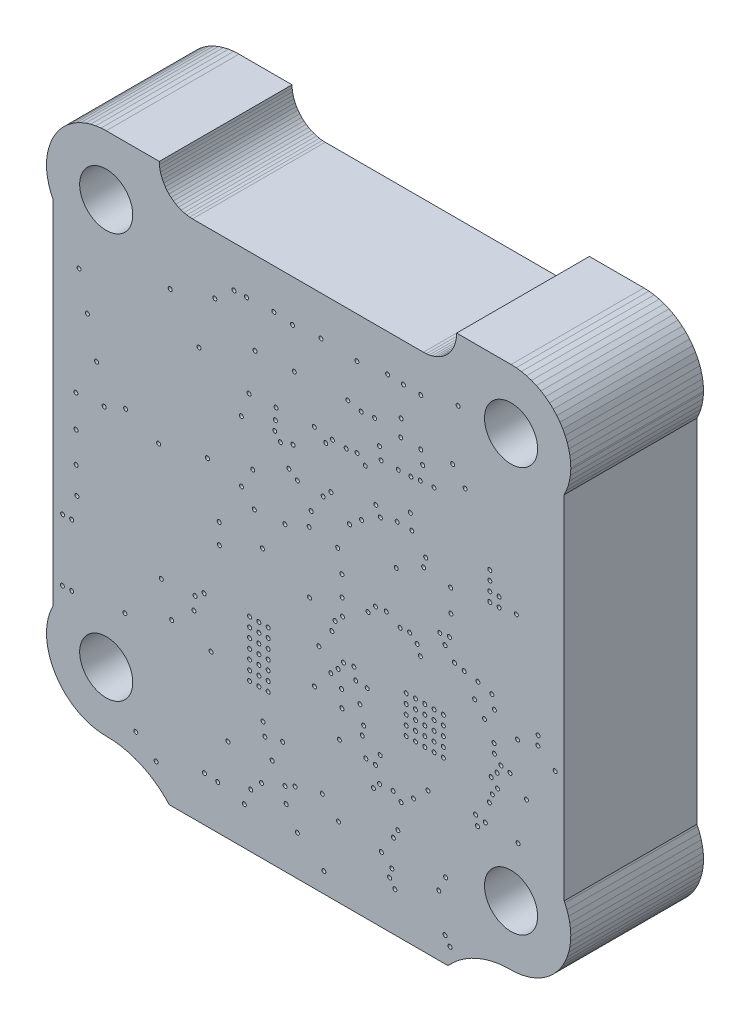
from build123d import *

# Parameters (mm, degrees)
MODEL_R         = 2
MODEL_R_2       = 0.15
EXTRUDE_1_DEPTH = 10


with BuildPart() as part:
    # Model → Бобышка-Вытянуть1 (new body)
    with BuildSketch(Plane.XY):
        Polygon((0, 6.6), (0.017125, 6.2078), (0.068365625, 5.818584375), (0.153334375, 5.435315625), (0.271384375, 5.060909375), (0.421615625, 4.69821875), (0.602884375, 4.350003125), (0.813815625, 4.018909375), (1.0528, 3.70745625), (1.31801875, 3.418021875), (1.607453125, 3.152803125), (1.91890625, 2.91381875), (2.249996875, 2.7028875), (2.598215625, 2.52161875), (2.96090625, 2.3713875), (3.3353125, 2.2533375), (3.71858125, 2.16836875), (4.107796875, 2.117128125), (4.5, 2.1), (5.0555625, 2.07761875), (5.6070625, 2.006903125), (6.1503, 1.8883875), (6.681140625, 1.722978125), (7.195546875, 1.511934375), (7.6896, 1.256859375), (8.159540625, 0.95969375), (8.60179375, 0.6227), (9.01299375, 0.248446875), (9.25, 0), (30.25, 0), (30.64045, 0.39585625), (31.0639125, 0.756175), (31.51716875, 1.07821875), (31.99676875, 1.359528125), (32.4990625, 1.597971875), (33.020225, 1.791728125), (33.556290625, 1.939325), (34.10318125, 2.039640625), (34.656734375, 2.09190625), (35, 2.1), (35.3922, 2.117125), (35.781415625, 2.168365625), (36.164684375, 2.253334375), (36.539090625, 2.371384375), (36.90178125, 2.521615625), (37.25, 2.702884375), (37.58109375, 2.913815625), (37.89254375, 3.1528), (38.18198125, 3.41801875), (38.4472, 3.70745625), (38.686184375, 4.01890625), (38.897115625, 4.35), (39.078384375, 4.69821875), (39.228615625, 5.060909375), (39.346665625, 5.435315625), (39.431634375, 5.818584375), (39.482875, 6.2078), (39.5, 6.6), (39.477784375, 6.9907625), (39.421596875, 7.3781), (39.331865625, 7.75906875), (39.209271875, 8.130765625), (39.054746875, 8.490365625), (39, 8.6), (39, 35.1), (39.1642875, 35.45524375), (39.2969875, 35.823453125), (39.397090625, 36.20183125), (39.463834375, 36.587490625), (39.4967125, 36.9775), (39.5, 37.1), (39.482875, 37.4922), (39.431634375, 37.881415625), (39.346665625, 38.264684375), (39.228615625, 38.639090625), (39.078384375, 39.00178125), (38.897115625, 39.35), (38.686184375, 39.68109375), (38.4472, 39.99254375), (38.18198125, 40.28198125), (37.89254375, 40.5472), (37.58109375, 40.786184375), (37.25, 40.997115625), (36.90178125, 41.178384375), (36.539090625, 41.328615625), (36.164684375, 41.446665625), (35.781415625, 41.531634375), (35.3922, 41.582875), (35, 41.6), (30.9, 41.6), (30.8904875, 41.382109375), (30.86201875, 41.165878125), (30.814815625, 40.952953125), (30.74923125, 40.74495), (30.66576875, 40.543453125), (30.5650625, 40.35), (30.44788125, 40.166059375), (30.3151125, 39.99303125), (30.167765625, 39.832234375), (30.00696875, 39.6848875), (29.833940625, 39.55211875), (29.65, 39.4349375), (29.456546875, 39.33423125), (29.25505, 39.25076875), (29.047046875, 39.185184375), (28.834121875, 39.13798125), (28.617890625, 39.1095125), (28.4, 39.1), (11, 39.1), (10.782109375, 39.1095125), (10.565878125, 39.13798125), (10.352953125, 39.185184375), (10.14495, 39.25076875), (9.943453125, 39.33423125), (9.75, 39.4349375), (9.566059375, 39.55211875), (9.39303125, 39.6848875), (9.232234375, 39.832234375), (9.0848875, 39.99303125), (8.95211875, 40.166059375), (8.8349375, 40.35), (8.73423125, 40.543453125), (8.65076875, 40.74495), (8.585184375, 40.952953125), (8.53798125, 41.165878125), (8.5095125, 41.382109375), (8.5, 41.6), (4.5, 41.6), (4.1078, 41.582875), (3.718584375, 41.531634375), (3.335315625, 41.446665625), (2.960909375, 41.32861875), (2.59821875, 41.1783875), (2.25, 40.997115625), (1.91890625, 40.7861875), (1.60745625, 40.547203125), (1.31801875, 40.28198125), (1.0528, 39.992546875), (0.813815625, 39.681096875), (0.602884375, 39.350003125), (0.4216125, 39.001784375), (0.27138125, 38.63909375), (0.15333125, 38.2646875), (0.0683625, 37.88141875), (0.017121875, 37.492203125), (0, 37.1), (0.022215625, 36.7092375), (0.0784, 36.3219), (0.168134375, 35.94093125), (0.290728125, 35.569234375), (0.44525, 35.2096375), (0.5, 35.1), (0.5, 8.6), (0.3357125, 8.24475625), (0.2030125, 7.876546875), (0.102909375, 7.498171875), (0.0361625, 7.1125125), (0.003284375, 6.722503125), align=None)
        with Locations((4.5, 37.1)):
            Circle(MODEL_R, mode=Mode.SUBTRACT)
        with Locations((35, 37.1)):
            Circle(MODEL_R, mode=Mode.SUBTRACT)
        with Locations((4.5, 6.6)):
            Circle(MODEL_R, mode=Mode.SUBTRACT)
        with Locations((35, 6.6)):
            Circle(MODEL_R, mode=Mode.SUBTRACT)
        with Locations((4.343, 23.53)):
            Circle(MODEL_R_2, mode=Mode.SUBTRACT)
        with Locations((14.68, 28.07)):
            Circle(MODEL_R_2, mode=Mode.SUBTRACT)
        with Locations((3.08, 28.96)):
            Circle(MODEL_R_2, mode=Mode.SUBTRACT)
        with Locations((2.45, 31.59)):
            Circle(MODEL_R_2, mode=Mode.SUBTRACT)
        with Locations((17.96, 22.66)):
            Circle(MODEL_R_2, mode=Mode.SUBTRACT)
        with Locations((16.27, 20.24)):
            Circle(MODEL_R_2, mode=Mode.SUBTRACT)
        with Locations((14.69, 23.49)):
            Circle(MODEL_R_2, mode=Mode.SUBTRACT)
        with Locations((18.9, 25.99)):
            Circle(MODEL_R_2, mode=Mode.SUBTRACT)
        with Locations((17.6227125, 27.8372875)):
            Circle(MODEL_R_2, mode=Mode.SUBTRACT)
        with Locations((16, 13.2)):
            Circle(MODEL_R_2, mode=Mode.SUBTRACT)
        with Locations((28.5, 14.8)):
            Circle(MODEL_R_2, mode=Mode.SUBTRACT)
        with Locations((22.26, 12.8)):
            Circle(MODEL_R_2, mode=Mode.SUBTRACT)
        with Locations((8.45, 23.16)):
            Circle(MODEL_R_2, mode=Mode.SUBTRACT)
        with Locations((12.13, 24.05)):
            Circle(MODEL_R_2, mode=Mode.SUBTRACT)
        with Locations((36.16, 13.79)):
            Circle(MODEL_R_2, mode=Mode.SUBTRACT)
        with Locations((20.9, 1.5)):
            Circle(MODEL_R_2, mode=Mode.SUBTRACT)
        with Locations((16.45, 8.04)):
            Circle(MODEL_R_2, mode=Mode.SUBTRACT)
        with Locations((25.14, 11.18)):
            Circle(MODEL_R_2, mode=Mode.SUBTRACT)
        with Locations((21.040575, 29.502)):
            Circle(MODEL_R_2, mode=Mode.SUBTRACT)
        with Locations((30.06574375, 5.67425625)):
            Circle(MODEL_R_2, mode=Mode.SUBTRACT)
        with Locations((31.01, 36.91)):
            Circle(MODEL_R_2, mode=Mode.SUBTRACT)
        with Locations((29.19, 30.67)):
            Circle(MODEL_R_2, mode=Mode.SUBTRACT)
        with Locations((23.39, 36.01)):
            Circle(MODEL_R_2, mode=Mode.SUBTRACT)
        with Locations((18.53, 35.952)):
            Circle(MODEL_R_2, mode=Mode.SUBTRACT)
        with Locations((22.7, 33.11)):
            Circle(MODEL_R_2, mode=Mode.SUBTRACT)
        with Locations((15.07, 36.02)):
            Circle(MODEL_R_2, mode=Mode.SUBTRACT)
        with Locations((38.325, 16.73)):
            Circle(MODEL_R_2, mode=Mode.SUBTRACT)
        with Locations((35.49, 17.368)):
            Circle(MODEL_R_2, mode=Mode.SUBTRACT)
        with Locations((37.02, 17.743)):
            Circle(MODEL_R_2, mode=Mode.SUBTRACT)
        with Locations((19.79, 23.4)):
            Circle(MODEL_R_2, mode=Mode.SUBTRACT)
        with Locations((22.83, 25.09)):
            Circle(MODEL_R_2, mode=Mode.SUBTRACT)
        with Locations((26.69, 32.69)):
            Circle(MODEL_R_2, mode=Mode.SUBTRACT)
        with Locations((35.53, 10.63)):
            Circle(MODEL_R_2, mode=Mode.SUBTRACT)
        with Locations((30.4, 1.31)):
            Circle(MODEL_R_2, mode=Mode.SUBTRACT)
        with Locations((22, 5.28)):
            Circle(MODEL_R_2, mode=Mode.SUBTRACT)
        with Locations((25.23, 4.908)):
            Circle(MODEL_R_2, mode=Mode.SUBTRACT)
        with Locations((1.9, 14.93)):
            Circle(MODEL_R_2, mode=Mode.SUBTRACT)
        with Locations((1.22, 14.93)):
            Circle(MODEL_R_2, mode=Mode.SUBTRACT)
        with Locations((1.9, 10.28)):
            Circle(MODEL_R_2, mode=Mode.SUBTRACT)
        with Locations((1.2, 10.27)):
            Circle(MODEL_R_2, mode=Mode.SUBTRACT)
        with Locations((25.21, 30.45)):
            Circle(MODEL_R_2, mode=Mode.SUBTRACT)
        with Locations((22.58, 29.91)):
            Circle(MODEL_R_2, mode=Mode.SUBTRACT)
        with Locations((35.4, 25.5)):
            Circle(MODEL_R_2, mode=Mode.SUBTRACT)
        with Locations((28.57, 25.79)):
            Circle(MODEL_R_2, mode=Mode.SUBTRACT)
        with Locations((26.42, 27.05)):
            Circle(MODEL_R_2, mode=Mode.SUBTRACT)
        with Locations((33.4, 27.4)):
            Circle(MODEL_R_2, mode=Mode.SUBTRACT)
        with Locations((33.4, 26.7)):
            Circle(MODEL_R_2, mode=Mode.SUBTRACT)
        with Locations((33.4, 26)):
            Circle(MODEL_R_2, mode=Mode.SUBTRACT)
        with Locations((33.4, 25.3)):
            Circle(MODEL_R_2, mode=Mode.SUBTRACT)
        with Locations((34.1, 25.3)):
            Circle(MODEL_R_2, mode=Mode.SUBTRACT)
        with Locations((34.1, 26)):
            Circle(MODEL_R_2, mode=Mode.SUBTRACT)
        with Locations((29.2, 14.8)):
            Circle(MODEL_R_2, mode=Mode.SUBTRACT)
        with Locations((29.2, 14.1)):
            Circle(MODEL_R_2, mode=Mode.SUBTRACT)
        with Locations((28.5, 14.1)):
            Circle(MODEL_R_2, mode=Mode.SUBTRACT)
        with Locations((27.8, 14.1)):
            Circle(MODEL_R_2, mode=Mode.SUBTRACT)
        with Locations((27.8, 14.8)):
            Circle(MODEL_R_2, mode=Mode.SUBTRACT)
        with Locations((27.8, 15.5)):
            Circle(MODEL_R_2, mode=Mode.SUBTRACT)
        with Locations((28.5, 15.5)):
            Circle(MODEL_R_2, mode=Mode.SUBTRACT)
        with Locations((29.2, 15.5)):
            Circle(MODEL_R_2, mode=Mode.SUBTRACT)
        with Locations((28.5, 16.2)):
            Circle(MODEL_R_2, mode=Mode.SUBTRACT)
        with Locations((27.8, 16.2)):
            Circle(MODEL_R_2, mode=Mode.SUBTRACT)
        with Locations((27.1, 16.2)):
            Circle(MODEL_R_2, mode=Mode.SUBTRACT)
        with Locations((27.1, 15.5)):
            Circle(MODEL_R_2, mode=Mode.SUBTRACT)
        with Locations((27.1, 14.8)):
            Circle(MODEL_R_2, mode=Mode.SUBTRACT)
        with Locations((27.1, 14.1)):
            Circle(MODEL_R_2, mode=Mode.SUBTRACT)
        with Locations((27.1, 13.4)):
            Circle(MODEL_R_2, mode=Mode.SUBTRACT)
        with Locations((27.8, 13.4)):
            Circle(MODEL_R_2, mode=Mode.SUBTRACT)
        with Locations((28.5, 13.4)):
            Circle(MODEL_R_2, mode=Mode.SUBTRACT)
        with Locations((29.2, 13.4)):
            Circle(MODEL_R_2, mode=Mode.SUBTRACT)
        with Locations((29.2, 16.2)):
            Circle(MODEL_R_2, mode=Mode.SUBTRACT)
        with Locations((29.9, 16.2)):
            Circle(MODEL_R_2, mode=Mode.SUBTRACT)
        with Locations((29.9, 15.5)):
            Circle(MODEL_R_2, mode=Mode.SUBTRACT)
        with Locations((29.9, 14.8)):
            Circle(MODEL_R_2, mode=Mode.SUBTRACT)
        with Locations((29.9, 14.1)):
            Circle(MODEL_R_2, mode=Mode.SUBTRACT)
        with Locations((29.9, 13.4)):
            Circle(MODEL_R_2, mode=Mode.SUBTRACT)
        with Locations((16, 13.9)):
            Circle(MODEL_R_2, mode=Mode.SUBTRACT)
        with Locations((16, 14.6)):
            Circle(MODEL_R_2, mode=Mode.SUBTRACT)
        with Locations((16, 15.3)):
            Circle(MODEL_R_2, mode=Mode.SUBTRACT)
        with Locations((16, 12.5)):
            Circle(MODEL_R_2, mode=Mode.SUBTRACT)
        with Locations((16, 11.8)):
            Circle(MODEL_R_2, mode=Mode.SUBTRACT)
        with Locations((16, 11.1)):
            Circle(MODEL_R_2, mode=Mode.SUBTRACT)
        with Locations((15.3, 11.1)):
            Circle(MODEL_R_2, mode=Mode.SUBTRACT)
        with Locations((15.3, 11.8)):
            Circle(MODEL_R_2, mode=Mode.SUBTRACT)
        with Locations((15.3, 12.5)):
            Circle(MODEL_R_2, mode=Mode.SUBTRACT)
        with Locations((15.3, 13.2)):
            Circle(MODEL_R_2, mode=Mode.SUBTRACT)
        with Locations((15.3, 13.9)):
            Circle(MODEL_R_2, mode=Mode.SUBTRACT)
        with Locations((15.3, 14.6)):
            Circle(MODEL_R_2, mode=Mode.SUBTRACT)
        with Locations((15.3, 15.3)):
            Circle(MODEL_R_2, mode=Mode.SUBTRACT)
        with Locations((16.7, 15.3)):
            Circle(MODEL_R_2, mode=Mode.SUBTRACT)
        with Locations((16.7, 14.6)):
            Circle(MODEL_R_2, mode=Mode.SUBTRACT)
        with Locations((16.7, 13.9)):
            Circle(MODEL_R_2, mode=Mode.SUBTRACT)
        with Locations((16.7, 13.2)):
            Circle(MODEL_R_2, mode=Mode.SUBTRACT)
        with Locations((16.7, 12.5)):
            Circle(MODEL_R_2, mode=Mode.SUBTRACT)
        with Locations((16.7, 11.8)):
            Circle(MODEL_R_2, mode=Mode.SUBTRACT)
        with Locations((16.7, 11.1)):
            Circle(MODEL_R_2, mode=Mode.SUBTRACT)
        with Locations((24.63, 8.78)):
            Circle(MODEL_R_2, mode=Mode.SUBTRACT)
        with Locations((21.54, 29.96)):
            Circle(MODEL_R_2, mode=Mode.SUBTRACT)
        with Locations((24.78, 10.37)):
            Circle(MODEL_R_2, mode=Mode.SUBTRACT)
        with Locations((21.43, 26.49)):
            Circle(MODEL_R_2, mode=Mode.SUBTRACT)
        with Locations((33.748, 15.576)):
            Circle(MODEL_R_2, mode=Mode.SUBTRACT)
        with Locations((18.57, 28.15)):
            Circle(MODEL_R_2, mode=Mode.SUBTRACT)
        with Locations((34.2371375, 15.0577125)):
            Circle(MODEL_R_2, mode=Mode.SUBTRACT)
        with Locations((17.198, 28.37)):
            Circle(MODEL_R_2, mode=Mode.SUBTRACT)
        with Locations((33.5, 13.93)):
            Circle(MODEL_R_2, mode=Mode.SUBTRACT)
        with Locations((17.3, 29.93)):
            Circle(MODEL_R_2, mode=Mode.SUBTRACT)
        with Locations((33.948, 14.439425)):
            Circle(MODEL_R_2, mode=Mode.SUBTRACT)
        with Locations((17.25, 29.09)):
            Circle(MODEL_R_2, mode=Mode.SUBTRACT)
        with Locations((2.29, 16.67)):
            Circle(MODEL_R_2, mode=Mode.SUBTRACT)
        with Locations((2.23, 18.67)):
            Circle(MODEL_R_2, mode=Mode.SUBTRACT)
        with Locations((2.23, 20.96)):
            Circle(MODEL_R_2, mode=Mode.SUBTRACT)
        with Locations((2.21, 23.37)):
            Circle(MODEL_R_2, mode=Mode.SUBTRACT)
        with Locations((18.67, 32.97)):
            Circle(MODEL_R_2, mode=Mode.SUBTRACT)
        with Locations((24.72, 32.97)):
            Circle(MODEL_R_2, mode=Mode.SUBTRACT)
        with Locations((31.5398, 31.7798)):
            Circle(MODEL_R_2, mode=Mode.SUBTRACT)
        with Locations((27.52, 27.02)):
            Circle(MODEL_R_2, mode=Mode.SUBTRACT)
        with Locations((30.47, 23.08)):
            Circle(MODEL_R_2, mode=Mode.SUBTRACT)
        with Locations((9.32, 33.68)):
            Circle(MODEL_R_2, mode=Mode.SUBTRACT)
        with Locations((5.96, 24.19)):
            Circle(MODEL_R_2, mode=Mode.SUBTRACT)
        with Locations((26.25, 2.99)):
            Circle(MODEL_R_2, mode=Mode.SUBTRACT)
        with Locations((18.9, 3)):
            Circle(MODEL_R_2, mode=Mode.SUBTRACT)
        with Locations((26.64, 20.24)):
            Circle(MODEL_R_2, mode=Mode.SUBTRACT)
        with Locations((18.73, 5.93)):
            Circle(MODEL_R_2, mode=Mode.SUBTRACT)
        with Locations((27.36, 20.29)):
            Circle(MODEL_R_2, mode=Mode.SUBTRACT)
        with Locations((20.778, 6.48)):
            Circle(MODEL_R_2, mode=Mode.SUBTRACT)
        with Locations((26.468, 6.95)):
            Circle(MODEL_R_2, mode=Mode.SUBTRACT)
        with Locations((32.47, 10.21)):
            Circle(MODEL_R_2, mode=Mode.SUBTRACT)
        with Locations((17.97, 5.59)):
            Circle(MODEL_R_2, mode=Mode.SUBTRACT)
        with Locations((16.2, 4.9)):
            Circle(MODEL_R_2, mode=Mode.SUBTRACT)
        with Locations((34.9141375, 14.91)):
            Circle(MODEL_R_2, mode=Mode.SUBTRACT)
        with Locations((26.35, 24)):
            Circle(MODEL_R_2, mode=Mode.SUBTRACT)
        with Locations((37.04, 18.42)):
            Circle(MODEL_R_2, mode=Mode.SUBTRACT)
        with Locations((24.016425, 29.502)):
            Circle(MODEL_R_2, mode=Mode.SUBTRACT)
        with Locations((23.74, 25.825)):
            Circle(MODEL_R_2, mode=Mode.SUBTRACT)
        with Locations((23.3, 15.13)):
            Circle(MODEL_R_2, mode=Mode.SUBTRACT)
        with Locations((22.07, 10.65)):
            Circle(MODEL_R_2, mode=Mode.SUBTRACT)
        with Locations((13.01, 20.33)):
            Circle(MODEL_R_2, mode=Mode.SUBTRACT)
        with Locations((15.26074375, 29.82925625)):
            Circle(MODEL_R_2, mode=Mode.SUBTRACT)
        with Locations((11.49, 30.96)):
            Circle(MODEL_R_2, mode=Mode.SUBTRACT)
        with Locations((17, 6.76)):
            Circle(MODEL_R_2, mode=Mode.SUBTRACT)
        with Locations((28.17, 19.15)):
            Circle(MODEL_R_2, mode=Mode.SUBTRACT)
        with Locations((27.4104625, 28.1296)):
            Circle(MODEL_R_2, mode=Mode.SUBTRACT)
        with Locations((27.92, 19.83)):
            Circle(MODEL_R_2, mode=Mode.SUBTRACT)
        with Locations((25.15, 26.7)):
            Circle(MODEL_R_2, mode=Mode.SUBTRACT)
        with Locations((26.89, 36.24)):
            Circle(MODEL_R_2, mode=Mode.SUBTRACT)
        with Locations((26.503, 30.48)):
            Circle(MODEL_R_2, mode=Mode.SUBTRACT)
        with Locations((28.16, 30.6)):
            Circle(MODEL_R_2, mode=Mode.SUBTRACT)
        with Locations((28.198, 36.21)):
            Circle(MODEL_R_2, mode=Mode.SUBTRACT)
        with Locations((23.71, 32.88)):
            Circle(MODEL_R_2, mode=Mode.SUBTRACT)
        with Locations((26.72, 33.95)):
            Circle(MODEL_R_2, mode=Mode.SUBTRACT)
        with Locations((26.11, 9.34)):
            Circle(MODEL_R_2, mode=Mode.SUBTRACT)
        with Locations((23.4, 30.023)):
            Circle(MODEL_R_2, mode=Mode.SUBTRACT)
        with Locations((26.71, 8.9)):
            Circle(MODEL_R_2, mode=Mode.SUBTRACT)
        with Locations((20.18, 30.123)):
            Circle(MODEL_R_2, mode=Mode.SUBTRACT)
        with Locations((33.06, 10.75)):
            Circle(MODEL_R_2, mode=Mode.SUBTRACT)
        with Locations((30.4475125, 24.772)):
            Circle(MODEL_R_2, mode=Mode.SUBTRACT)
        with Locations((26.02, 4.2247125)):
            Circle(MODEL_R_2, mode=Mode.SUBTRACT)
        with Locations((32.325, 10.895)):
            Circle(MODEL_R_2, mode=Mode.SUBTRACT)
        with Locations((28.412, 25.072)):
            Circle(MODEL_R_2, mode=Mode.SUBTRACT)
        with Locations((25.8502875, 3.5477125)):
            Circle(MODEL_R_2, mode=Mode.SUBTRACT)
        with Locations((33.9737125, 13.4237125)):
            Circle(MODEL_R_2, mode=Mode.SUBTRACT)
        with Locations((28.198, 32.66)):
            Circle(MODEL_R_2, mode=Mode.SUBTRACT)
        with Locations((23.9, 12.487)):
            Circle(MODEL_R_2, mode=Mode.SUBTRACT)
        with Locations((20.52, 15.978)):
            Circle(MODEL_R_2, mode=Mode.SUBTRACT)
        with Locations((23.61, 13.74)):
            Circle(MODEL_R_2, mode=Mode.SUBTRACT)
        with Locations((21.5, 17.46)):
            Circle(MODEL_R_2, mode=Mode.SUBTRACT)
        with Locations((20.1894875, 13.192)):
            Circle(MODEL_R_2, mode=Mode.SUBTRACT)
        with Locations((23.79, 11.79)):
            Circle(MODEL_R_2, mode=Mode.SUBTRACT)
        with Locations((22.23, 14.05)):
            Circle(MODEL_R_2, mode=Mode.SUBTRACT)
        with Locations((20.68, 36.14)):
            Circle(MODEL_R_2, mode=Mode.SUBTRACT)
        with Locations((25.7, 36.3)):
            Circle(MODEL_R_2, mode=Mode.SUBTRACT)
        with Locations((30.6, 32.9)):
            Circle(MODEL_R_2, mode=Mode.SUBTRACT)
        with Locations((28.34, 31.71)):
            Circle(MODEL_R_2, mode=Mode.SUBTRACT)
        with Locations((12.68, 34.75)):
            Circle(MODEL_R_2, mode=Mode.SUBTRACT)
        with Locations((6.73, 3.5)):
            Circle(MODEL_R_2, mode=Mode.SUBTRACT)
        with Locations((15.54, 25.01)):
            Circle(MODEL_R_2, mode=Mode.SUBTRACT)
        with Locations((27.45, 30.51)):
            Circle(MODEL_R_2, mode=Mode.SUBTRACT)
        with Locations((25.087, 31.31325625)):
            Circle(MODEL_R_2, mode=Mode.SUBTRACT)
        with Locations((16.31, 8.96)):
            Circle(MODEL_R_2, mode=Mode.SUBTRACT)
        with Locations((12.4, 11.57)):
            Circle(MODEL_R_2, mode=Mode.SUBTRACT)
        with Locations((11.87, 15.11)):
            Circle(MODEL_R_2, mode=Mode.SUBTRACT)
        with Locations((13.03, 18.82)):
            Circle(MODEL_R_2, mode=Mode.SUBTRACT)
        with Locations((11.108, 13.6005125)):
            Circle(MODEL_R_2, mode=Mode.SUBTRACT)
        with Locations((31.467, 19.8337875)):
            Circle(MODEL_R_2, mode=Mode.SUBTRACT)
        with Locations((21.74, 18.24)):
            Circle(MODEL_R_2, mode=Mode.SUBTRACT)
        with Locations((30.357, 21.5011375)):
            Circle(MODEL_R_2, mode=Mode.SUBTRACT)
        with Locations((19.82, 18.8)):
            Circle(MODEL_R_2, mode=Mode.SUBTRACT)
        with Locations((30.74, 20.01)):
            Circle(MODEL_R_2, mode=Mode.SUBTRACT)
        with Locations((22.3, 18.81)):
            Circle(MODEL_R_2, mode=Mode.SUBTRACT)
        with Locations((29.63, 21.41)):
            Circle(MODEL_R_2, mode=Mode.SUBTRACT)
        with Locations((22.26, 21.55)):
            Circle(MODEL_R_2, mode=Mode.SUBTRACT)
        with Locations((27.65, 9.61)):
            Circle(MODEL_R_2, mode=Mode.SUBTRACT)
        with Locations((30.03, 1.88)):
            Circle(MODEL_R_2, mode=Mode.SUBTRACT)
        with Locations((28.74, 10.67)):
            Circle(MODEL_R_2, mode=Mode.SUBTRACT)
        with Locations((29.555, 4.555)):
            Circle(MODEL_R_2, mode=Mode.SUBTRACT)
        with Locations((26.135, 6.288)):
            Circle(MODEL_R_2, mode=Mode.SUBTRACT)
        with Locations((33.59, 12.85)):
            Circle(MODEL_R_2, mode=Mode.SUBTRACT)
        with Locations((33.55, 19.37)):
            Circle(MODEL_R_2, mode=Mode.SUBTRACT)
        with Locations((15.39, 4.07)):
            Circle(MODEL_R_2, mode=Mode.SUBTRACT)
        with Locations((5.91, 10.83)):
            Circle(MODEL_R_2, mode=Mode.SUBTRACT)
        with Locations((33.36, 12.21)):
            Circle(MODEL_R_2, mode=Mode.SUBTRACT)
        with Locations((33.74, 18.45)):
            Circle(MODEL_R_2, mode=Mode.SUBTRACT)
        with Locations((24.06, 10.433)):
            Circle(MODEL_R_2, mode=Mode.SUBTRACT)
        with Locations((23.157, 15.963)):
            Circle(MODEL_R_2, mode=Mode.SUBTRACT)
        with Locations((33, 17.47)):
            Circle(MODEL_R_2, mode=Mode.SUBTRACT)
        with Locations((24.79, 20.7)):
            Circle(MODEL_R_2, mode=Mode.SUBTRACT)
        with Locations((21.97, 15.22)):
            Circle(MODEL_R_2, mode=Mode.SUBTRACT)
        with Locations((18.26, 26.43)):
            Circle(MODEL_R_2, mode=Mode.SUBTRACT)
        with Locations((14.91, 2.86)):
            Circle(MODEL_R_2, mode=Mode.SUBTRACT)
        with Locations((13.67, 6.34)):
            Circle(MODEL_R_2, mode=Mode.SUBTRACT)
        with Locations((21.94, 23.11)):
            Circle(MODEL_R_2, mode=Mode.SUBTRACT)
        with Locations((32.25, 18.38)):
            Circle(MODEL_R_2, mode=Mode.SUBTRACT)
        with Locations((24.81, 27.35)):
            Circle(MODEL_R_2, mode=Mode.SUBTRACT)
        with Locations((15.71, 32.85)):
            Circle(MODEL_R_2, mode=Mode.SUBTRACT)
        with Locations((17.13, 36.1)):
            Circle(MODEL_R_2, mode=Mode.SUBTRACT)
        with Locations((8.65, 14.44)):
            Circle(MODEL_R_2, mode=Mode.SUBTRACT)
        with Locations((14.123, 36)):
            Circle(MODEL_R_2, mode=Mode.SUBTRACT)
        with Locations((25.0937125, 9.2837125)):
            Circle(MODEL_R_2, mode=Mode.SUBTRACT)
        with Locations((15.66, 22.47)):
            Circle(MODEL_R_2, mode=Mode.SUBTRACT)
        with Locations((33.72, 16.253)):
            Circle(MODEL_R_2, mode=Mode.SUBTRACT)
        with Locations((18.06, 4.45)):
            Circle(MODEL_R_2, mode=Mode.SUBTRACT)
        with Locations((32.5, 19.65)):
            Circle(MODEL_R_2, mode=Mode.SUBTRACT)
        with Locations((3.77, 26.17)):
            Circle(MODEL_R_2, mode=Mode.SUBTRACT)
        with Locations((30.03, 20.8)):
            Circle(MODEL_R_2, mode=Mode.SUBTRACT)
        with Locations((22.27, 20.04)):
            Circle(MODEL_R_2, mode=Mode.SUBTRACT)
        with Locations((25.6, 20.78)):
            Circle(MODEL_R_2, mode=Mode.SUBTRACT)
        with Locations((22.37, 15.84)):
            Circle(MODEL_R_2, mode=Mode.SUBTRACT)
        with Locations((20.84, 25.91)):
            Circle(MODEL_R_2, mode=Mode.SUBTRACT)
        with Locations((24.23, 20.06)):
            Circle(MODEL_R_2, mode=Mode.SUBTRACT)
        with Locations((21.42, 14.67)):
            Circle(MODEL_R_2, mode=Mode.SUBTRACT)
        with Locations((19.94, 24.51)):
            Circle(MODEL_R_2, mode=Mode.SUBTRACT)
        with Locations((8.26, 2.33)):
            Circle(MODEL_R_2, mode=Mode.SUBTRACT)
        with Locations((12.9, 3.31)):
            Circle(MODEL_R_2, mode=Mode.SUBTRACT)
        with Locations((9.43, 12.14)):
            Circle(MODEL_R_2, mode=Mode.SUBTRACT)
        with Locations((11.19, 14.6)):
            Circle(MODEL_R_2, mode=Mode.SUBTRACT)
        with Locations((24.16, 15.06)):
            Circle(MODEL_R_2, mode=Mode.SUBTRACT)
        with Locations((17.79, 8.38)):
            Circle(MODEL_R_2, mode=Mode.SUBTRACT)
        with Locations((11.9, 3.39)):
            Circle(MODEL_R_2, mode=Mode.SUBTRACT)
    extrude(amount=EXTRUDE_1_DEPTH)


solid = part.part
